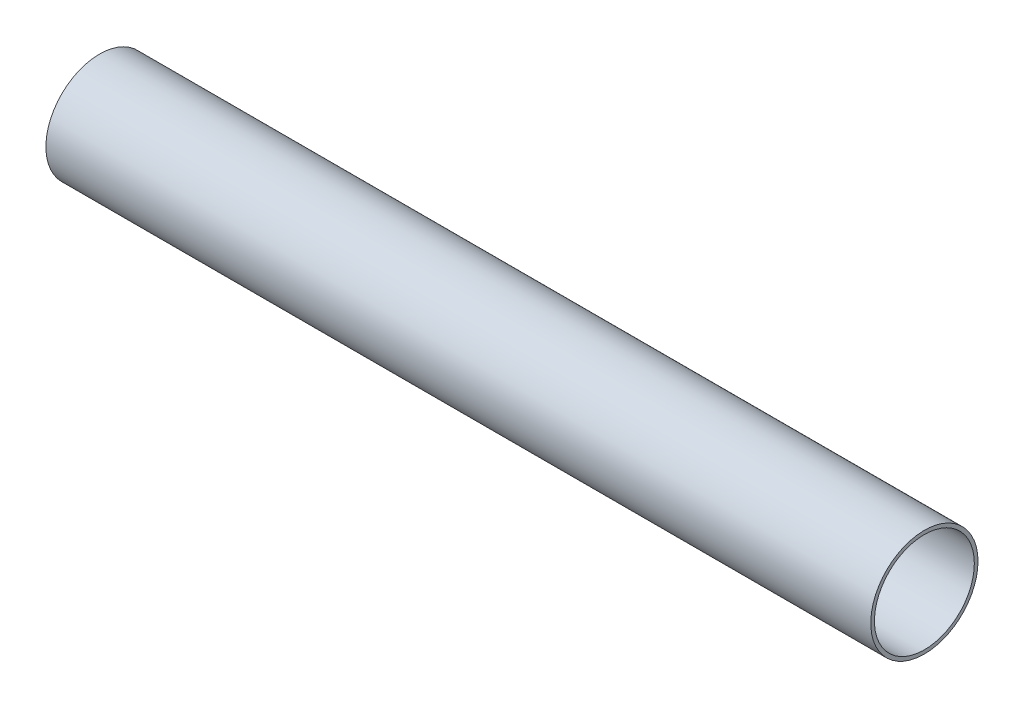
from build123d import *

# Parameters (mm, degrees)
SKETCH1_R           = 32.5
SKETCH1_R_2         = 30.275
BOSS_EXTRUDE1_DEPTH = 500


with BuildPart() as part:
    # Sketch1 → Boss-Extrude1 (new body)
    with BuildSketch(Plane(origin=(0, 0, 0), x_dir=(0, 0, -1), z_dir=(1, 0, 0))):
        with Locations((-22.270889708, -10.087402985)):
            Circle(SKETCH1_R)
        with Locations((-22.270889708, -10.087402985)):
            Circle(SKETCH1_R_2, mode=Mode.SUBTRACT)
    extrude(amount=BOSS_EXTRUDE1_DEPTH)


solid = part.part
